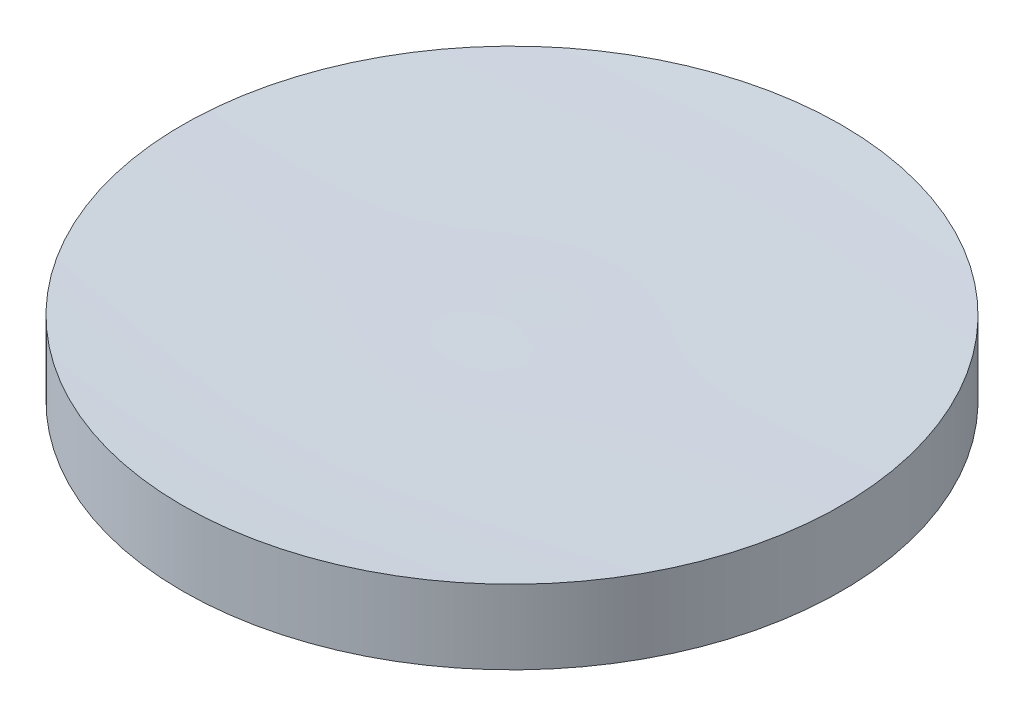
from build123d import *

# Parameters (mm, degrees)
SKETCH_1_R      = 80
EXTRUDE_1_DEPTH = 18


with BuildPart() as part:
    # Эскиз1 → Бобышка-Вытянуть1 (new body)
    with BuildSketch(Plane(origin=(0, 0, 0), x_dir=(1, 0, 0), z_dir=(0, 1, 0))):
        with Locations(Location((0, 0, 0), (0, 0, 270))):
            Circle(SKETCH_1_R)
    extrude(amount=EXTRUDE_1_DEPTH)

    # Эскиз3 → Вырез-Повернуть1 (revolve, cut)
    with BuildSketch(Plane(origin=(0, 0, 0), x_dir=(0, 0, -1), z_dir=(1, 0, 0)), mode=Mode.PRIVATE) as cut_revolve_1_sk:
        with BuildLine():
            ThreePointArc((-80, 18), (-40.009501459, 16.767018901), (0, 16.77))
            Line((0, 16.77), (0, 18))
            Line((0, 18), (-80, 18))
        make_face()
    revolve(cut_revolve_1_sk.sketch.rotate(Axis((0, 16.77, 0), (0, 1, 0)), 180), axis=Axis((0, 16.77, 0), (0, 1, 0)), mode=Mode.SUBTRACT)


solid = part.part
